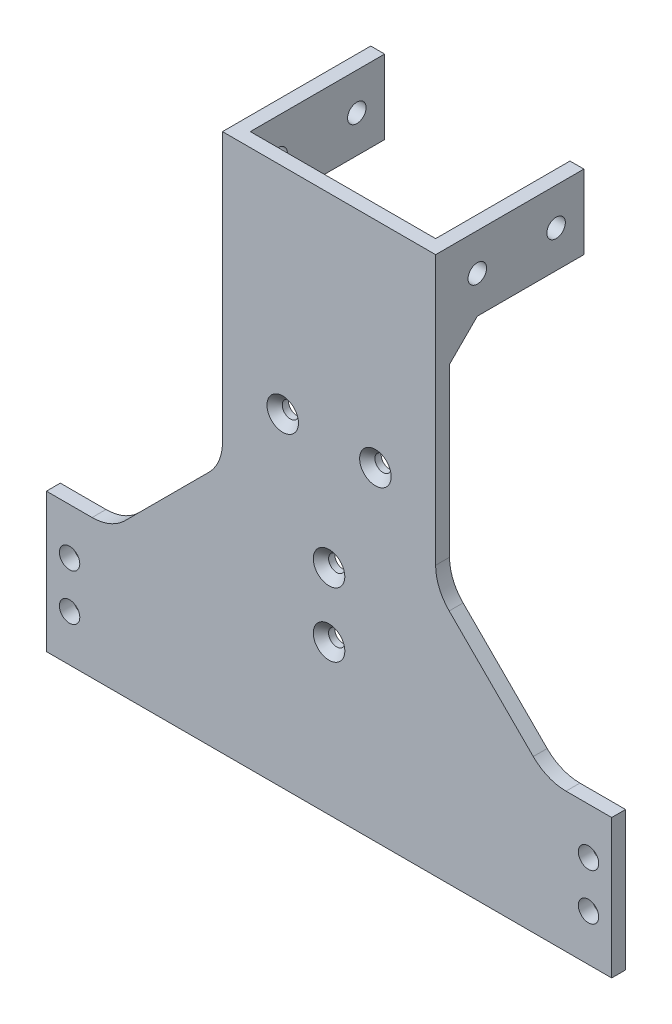
from build123d import *

# Parameters (mm, degrees)
SKETCH1_W           = 122
SKETCH1_H           = 30
SKETCH1_R           = 2.2
BOSS_EXTRUDE1_DEPTH = 3
SKETCH2_W           = 46
SKETCH2_H           = 86.2
SKETCH2_R           = 1.75
BOSS_EXTRUDE2_DEPTH = 3
BOSS_EXTRUDE3_DEPTH = 3
FILLET1_R           = 10
CHAMFER1_SIZE       = 1.65
SKETCH4_W           = 32
SKETCH4_H           = 16
SKETCH4_R           = 2
BOSS_EXTRUDE4_DEPTH = 3
CHAMFER2_SIZE       = 6


with BuildPart() as part:
    # Sketch1 → Boss-Extrude1 (new body)
    with BuildSketch(Plane.XY):
        Rectangle(SKETCH1_W, SKETCH1_H)
        with Locations((-56, 5)):
            Circle(SKETCH1_R, mode=Mode.SUBTRACT)
        with Locations(Location((-56, -5, 0), (0, 0, 180))):
            Circle(SKETCH1_R, mode=Mode.SUBTRACT)
        with Locations((56, -5)):
            Circle(SKETCH1_R, mode=Mode.SUBTRACT)
        with Locations(Location((56, 5, 0), (0, 0, 180))):
            Circle(SKETCH1_R, mode=Mode.SUBTRACT)
    extrude(amount=BOSS_EXTRUDE1_DEPTH)

    # Sketch2 → Boss-Extrude2 (add)
    with BuildSketch(Plane.XY.offset(3)):
        with Locations((0, 58.1)):
            Rectangle(SKETCH2_W, SKETCH2_H)
        with Locations((0, 17.3)):
            Circle(SKETCH2_R, mode=Mode.SUBTRACT)
        with Locations((10, 54.9)):
            Circle(SKETCH2_R, mode=Mode.SUBTRACT)
        with Locations((0, 31.2)):
            Circle(SKETCH2_R, mode=Mode.SUBTRACT)
        with Locations(Location((-10, 54.9, 0), (0, 0, 180))):
            Circle(SKETCH2_R, mode=Mode.SUBTRACT)
    extrude(amount=-BOSS_EXTRUDE2_DEPTH)

    # Sketch3 → Boss-Extrude3 (add)
    with BuildSketch(Plane.XY.offset(3)):
        Polygon((-47, 15), (-23, 39), (-23, 15), align=None)
        Polygon((23, 39), (23, 15), (47, 15), align=None)
    extrude(amount=-BOSS_EXTRUDE3_DEPTH)

    # Fillet1
    fillet1_edges = [part.edges().sort_by_distance(p)[0] for p in [
        (-47, 15, 1.5),
        (-23, 39, 1.5),
        (23, 39, 1.5),
        (47, 15, 1.5),
    ]]
    fillet(fillet1_edges, radius=FILLET1_R)

    # Chamfer1
    chamfer1_edges = [part.edges().sort_by_distance(p)[0] for p in [
        (-1.75, 17.3, 3),
        (8.25, 54.9, 3),
        (-1.75, 31.2, 3),
        (-8.25, 54.9, 3),
    ]]
    chamfer(chamfer1_edges, length=CHAMFER1_SIZE)

    # Sketch4 → Boss-Extrude4 (add)
    with BuildSketch(Plane(origin=(23, 0, 0), x_dir=(0, 0, -1), z_dir=(1, 0, 0))):
        with Locations((13, 93.2)):
            Rectangle(SKETCH4_W, SKETCH4_H)
        with Locations(Location((23, 93.2, 0), (0, 0, 90))):
            Circle(SKETCH4_R, mode=Mode.SUBTRACT)
        with Locations(Location((6, 93.2, 0), (0, 0, 270))):
            Circle(SKETCH4_R, mode=Mode.SUBTRACT)
    boss_extrude4 = extrude(amount=-BOSS_EXTRUDE4_DEPTH)

    # Mirror1: Boss-Extrude4 across plane
    add(boss_extrude4.mirror(Plane(origin=(0, 0, 0), x_dir=(0, 0, 1), z_dir=(1, 0, 0))))

    # Chamfer2
    chamfer2_edges = [part.edges().sort_by_distance(p)[0] for p in [
        (21.5, 85.2, 0),
        (-21.5, 85.2, 0),
    ]]
    chamfer(chamfer2_edges, length=CHAMFER2_SIZE)


solid = part.part
